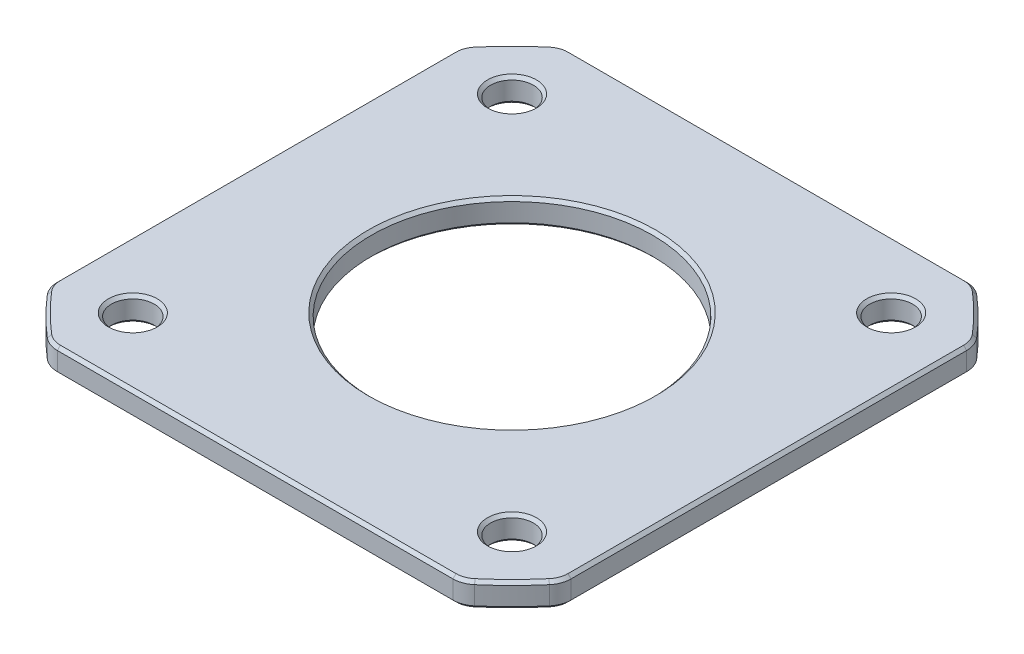
from build123d import *

# Parameters (mm, degrees)
SKETCH1_R           = 11.5
SKETCH1_R_2         = 1.75
BOSS_EXTRUDE1_DEPTH = 2
CHAMFER1_SIZE       = 0.25


with BuildPart() as part:
    # Sketch1 → Boss-Extrude1 (new body)
    with BuildSketch(Plane(origin=(0, 0, 0), x_dir=(1, 0, 0), z_dir=(0, 1, 0))):
        with BuildLine():
            Line((16.171038928, -21), (-16.171038928, -21))
            ThreePointArc((-16.171038928, -21), (-16.861657425, -20.876977915), (-17.467314594, -20.523046092))
            ThreePointArc((-17.467314594, -20.523046092), (-19.056527753, -19.056527753), (-20.523046092, -17.467314594))
            ThreePointArc((-20.523046092, -17.467314594), (-20.876977915, -16.861657425), (-21, -16.171038928))
            Line((-21, -16.171038928), (-21, 16.171038928))
            ThreePointArc((-21, 16.171038928), (-20.876977915, 16.861657425), (-20.523046092, 17.467314594))
            ThreePointArc((-20.523046092, 17.467314594), (-19.056527753, 19.056527753), (-17.467314594, 20.523046092))
            ThreePointArc((-17.467314594, 20.523046092), (-16.861657425, 20.876977915), (-16.171038928, 21))
            Line((-16.171038928, 21), (16.171038928, 21))
            ThreePointArc((16.171038928, 21), (16.861657425, 20.876977915), (17.467314594, 20.523046092))
            ThreePointArc((17.467314594, 20.523046092), (19.056527753, 19.056527753), (20.523046092, 17.467314594))
            ThreePointArc((20.523046092, 17.467314594), (20.876977915, 16.861657425), (21, 16.171038928))
            Line((21, 16.171038928), (21, -16.171038928))
            ThreePointArc((21, -16.171038928), (20.876977915, -16.861657425), (20.523046092, -17.467314594))
            ThreePointArc((20.523046092, -17.467314594), (19.056527753, -19.056527753), (17.467314594, -20.523046092))
            ThreePointArc((17.467314594, -20.523046092), (16.861657425, -20.876977915), (16.171038928, -21))
        make_face()
        with Locations(Location((0, 0, 0), (0, 0, 270))):
            Circle(SKETCH1_R, mode=Mode.SUBTRACT)
        with Locations(Location((15.5, -15.5, 0), (0, 0, 270))):
            Circle(SKETCH1_R_2, mode=Mode.SUBTRACT)
        with Locations(Location((15.5, 15.5, 0), (0, 0, 270))):
            Circle(SKETCH1_R_2, mode=Mode.SUBTRACT)
        with Locations(Location((-15.5, 15.5, 0), (0, 0, 270))):
            Circle(SKETCH1_R_2, mode=Mode.SUBTRACT)
        with Locations(Location((-15.5, -15.5, 0), (0, 0, 270))):
            Circle(SKETCH1_R_2, mode=Mode.SUBTRACT)
    extrude(amount=BOSS_EXTRUDE1_DEPTH)

    # Chamfer1
    chamfer1_edges = [part.edges().sort_by_distance(p)[0] for p in [
        (20.876977915, 2, 16.861657425),
        (21, 2, 0),
        (0, 0, 21),
        (-16.861657425, 0, 20.876977915),
        (-19.056527753, 0, 19.056527753),
        (-20.876977915, 0, 16.861657425),
        (-21, 0, 0),
        (20.876977915, 2, -16.861657425),
        (-20.876977915, 0, -16.861657425),
        (-19.056527753, 0, -19.056527753),
        (-16.861657425, 0, -20.876977915),
        (0, 0, -21),
        (16.861657425, 0, -20.876977915),
        (19.056527753, 0, -19.056527753),
        (20.876977915, 0, -16.861657425),
        (21, 0, 0),
        (19.056527753, 2, -19.056527753),
        (20.876977915, 0, 16.861657425),
        (19.056527753, 0, 19.056527753),
        (16.861657425, 0, 20.876977915),
        (16.861657425, 2, -20.876977915),
        (0, 2, -21),
        (-16.861657425, 2, -20.876977915),
        (-19.056527753, 2, -19.056527753),
        (-20.876977915, 2, -16.861657425),
        (-21, 2, 0),
        (0, 0, -11.5),
        (0, 2, -11.5),
        (16.861657425, 2, 20.876977915),
        (-20.876977915, 2, 16.861657425),
        (15.5, 0, 13.75),
        (15.5, 2, 13.75),
        (-19.056527753, 2, 19.056527753),
        (-16.861657425, 2, 20.876977915),
        (15.5, 0, -17.25),
        (15.5, 2, -17.25),
        (0, 2, 21),
        (-15.5, 0, -17.25),
        (-15.5, 2, -17.25),
        (-15.5, 0, 13.75),
        (-15.5, 2, 13.75),
        (19.056527753, 2, 19.056527753),
    ]]
    chamfer(chamfer1_edges, length=CHAMFER1_SIZE)


solid = part.part
